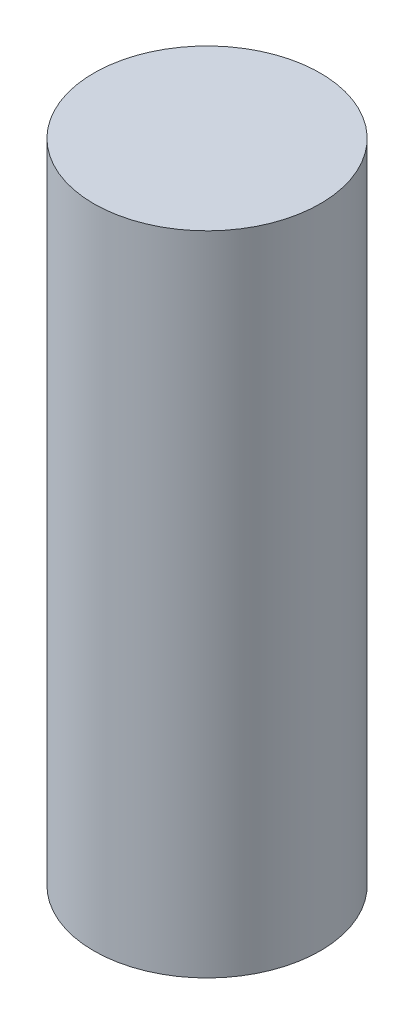
from build123d import *

# Parameters (mm, degrees)
SKETCH1_R           = 35.56
BOSS_EXTRUDE1_DEPTH = 101.6


with BuildPart() as part:
    # Sketch1 → Boss-Extrude1 (new, symmetric)
    with BuildSketch(Plane(origin=(0, 0, 0), x_dir=(1, 0, 0), z_dir=(0, 1, 0))):
        with Locations(Location((0, 0, 0), (0, 0, 270))):
            Circle(SKETCH1_R)
    extrude(amount=BOSS_EXTRUDE1_DEPTH, both=True)


solid = part.part
